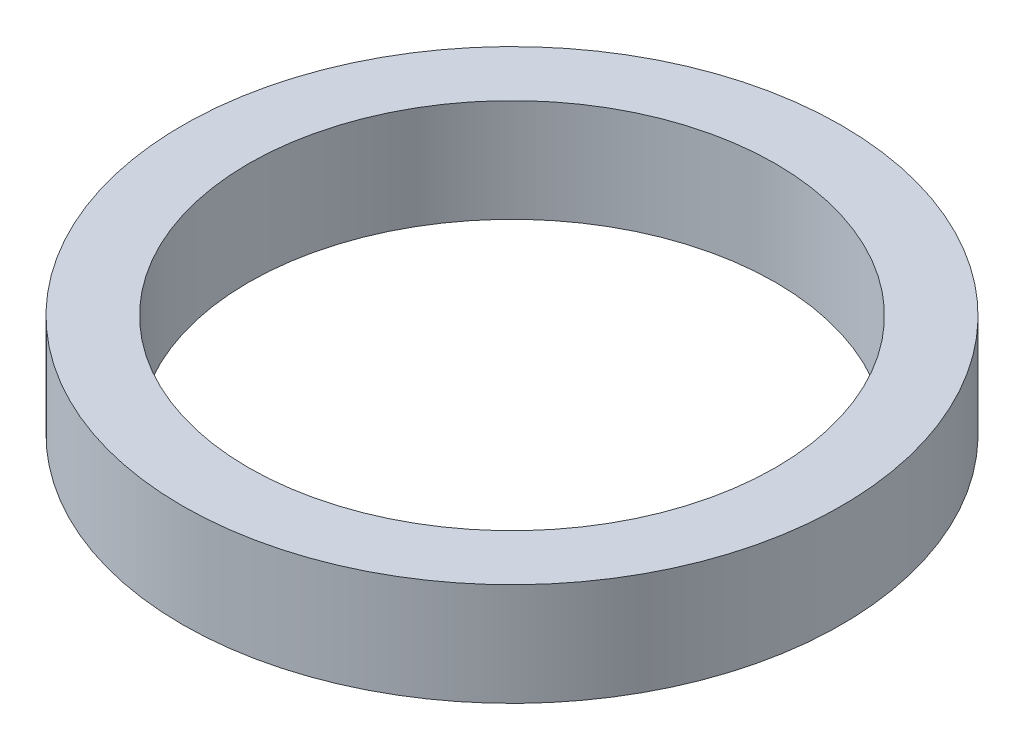
from build123d import *

# Parameters (mm, degrees)
CROQUIS1_R              = 12.825
CROQUIS1_R_2            = 10.25
SALIENTE_EXTRUIR1_DEPTH = 4


with BuildPart() as part:
    # Croquis1 → Saliente-Extruir1 (new body)
    with BuildSketch(Plane(origin=(0, 0, 0), x_dir=(1, 0, 0), z_dir=(0, 1, 0))):
        with Locations(Location((0, 0, 0), (0, 0, 270))):
            Circle(CROQUIS1_R)
        with Locations(Location((0, 0, 0), (0, 0, 270))):
            Circle(CROQUIS1_R_2, mode=Mode.SUBTRACT)
    extrude(amount=SALIENTE_EXTRUIR1_DEPTH)


solid = part.part
